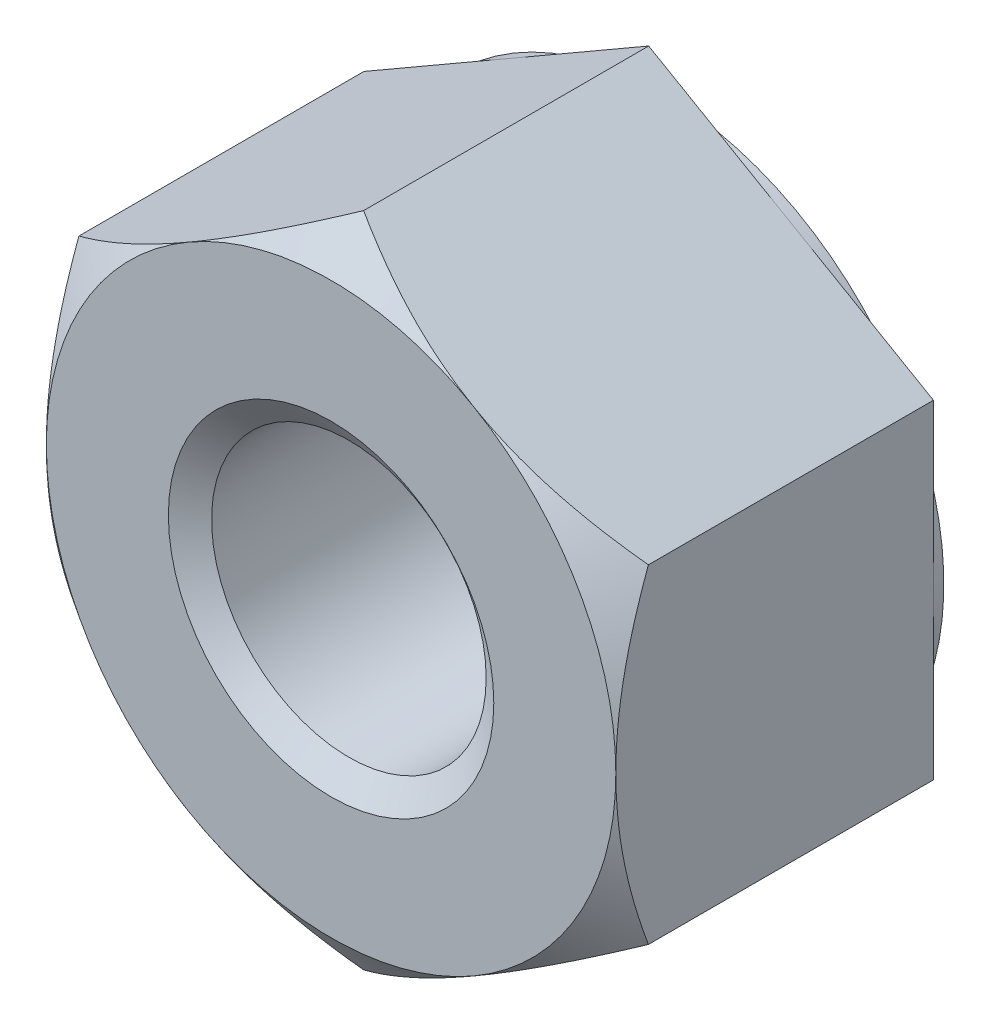
from build123d import *

# Parameters (mm, degrees)
BASENUT_START = -12.8016
BASENUTSKE_R  = 5.35813
BASENUT_DEPTH = 12.8016
SKETCH4_W     = 0.4064
SKETCH4_H     = 14.419109733


with BuildPart() as part:
    # BaseNutSke → BaseNut (new body)
    with BuildSketch(Plane.XY.offset(BASENUT_START)):
        Polygon((11.1125, 6.415804866), (11.1125, -6.415804866), (0, -12.831609733), (-11.1125, -6.415804866), (-11.1125, 6.415804866), (0, 12.831609733), align=None)
        Circle(BASENUTSKE_R, mode=Mode.SUBTRACT)
    extrude(amount=BASENUT_DEPTH)

    # Sketch4 → Bearing-Face (revolve, cut)
    with BuildSketch(Plane(origin=(0, 0, 0), x_dir=(0, 0, -1), z_dir=(1, 0, 0)), mode=Mode.PRIVATE) as bearing_face_sk:
        with Locations((12.5984, 18.322054867)):
            Rectangle(SKETCH4_W, SKETCH4_H)
        Polygon((0, 11.1125), (-12.7, 11.1125), (-12.7, 25.531609733), (1.27, 25.531609733), (1.27, 12.831609733), align=None)
    revolve(bearing_face_sk.sketch.rotate(Axis((0, 0, 0), (0, 0, -1)), 270), axis=Axis((0, 0, 0), (0, 0, -1)), mode=Mode.SUBTRACT)

    # Sketch5 → EndChamfer (revolve, cut)
    with BuildSketch(Plane(origin=(0, 0, 0), x_dir=(0, 0, -1), z_dir=(1, 0, 0)), mode=Mode.PRIVATE) as endchamfer_sk:
        Polygon((12.7762, 6.35), (12.012233664, 5.258943), (12.827, 5.258943), (12.827, 6.35), align=None)
        Polygon((-0.0508, 6.35), (0, 6.35), (0.763966336, 5.258943), (-0.0508, 5.258943), align=None)
    revolve(endchamfer_sk.sketch.rotate(Axis((0, 0, -25.037505729), (0, 0, -1)), 90), axis=Axis((0, 0, -25.037505729), (0, 0, -1)), mode=Mode.SUBTRACT)


solid = part.part
